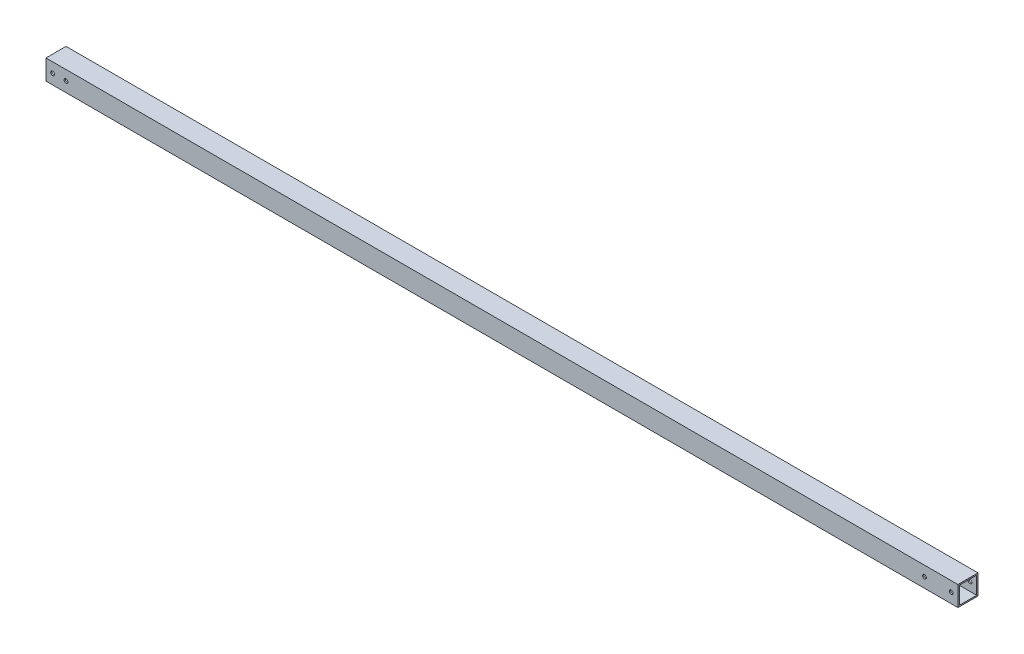
from build123d import *

# Parameters (mm, degrees)
SKETCH_1_W          = 15
SKETCH_1_H          = 15
SKETCH_1_W_2        = 13
SKETCH_1_H_2        = 13
EXTRUDE_1_DEPTH     = 681.8
SKETCH_2_R          = 1.45
CUT_EXTRUDE_1_DEPTH = 683.006224312


with BuildPart() as part:
    # 草图1 → 凸台-拉伸1 (new body)
    with BuildSketch(Plane(origin=(0, 0, 0), x_dir=(0, 0, -1), z_dir=(1, 0, 0))):
        Rectangle(SKETCH_1_W, SKETCH_1_H)
        Rectangle(SKETCH_1_W_2, SKETCH_1_H_2, mode=Mode.SUBTRACT)
    extrude(amount=EXTRUDE_1_DEPTH)

    # 草图2 → 切除-拉伸1 (cut, through all)
    with BuildSketch(Plane(origin=(0, 0, -7.5), x_dir=(-1, 0, 0), z_dir=(0, 0, -1))):
        with Locations((-5, 0)):
            Circle(SKETCH_2_R)
        with Locations((-15, 0)):
            Circle(SKETCH_2_R)
        with Locations((-656.800000002, 0)):
            Circle(SKETCH_2_R)
        with Locations((-676.800000002, 0)):
            Circle(SKETCH_2_R)
    extrude(amount=-CUT_EXTRUDE_1_DEPTH, mode=Mode.SUBTRACT)


solid = part.part
